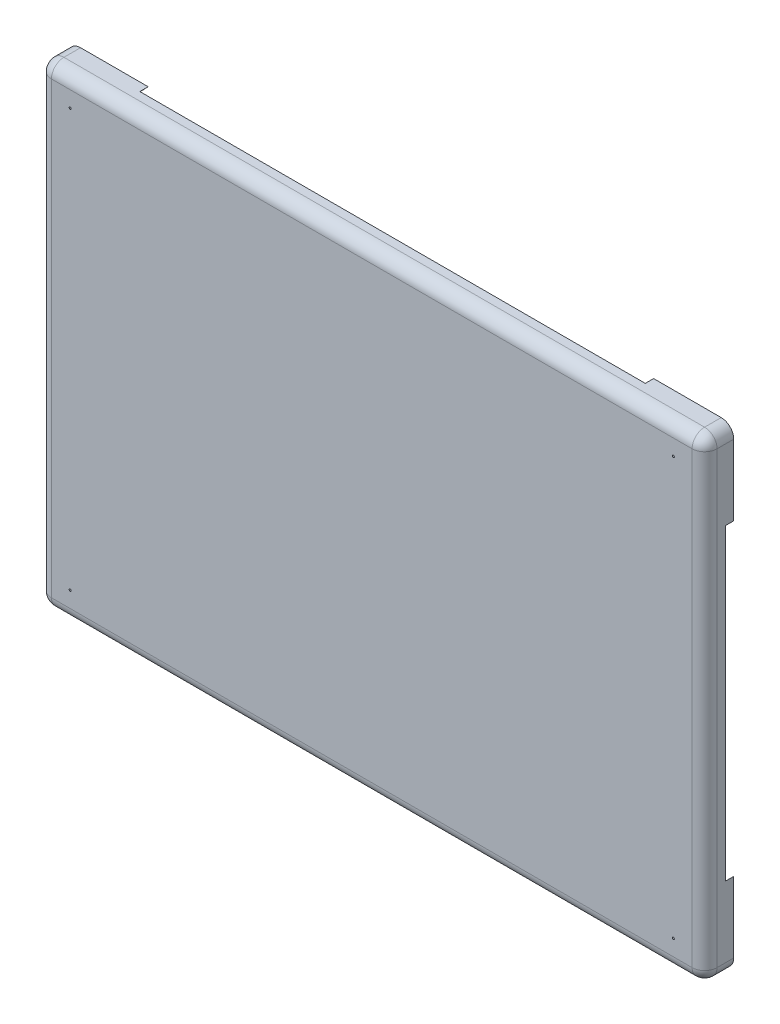
from build123d import *

# Parameters (mm, degrees)
SKETCH2_W                                = 160
SKETCH2_H                                = 114
BOSS_EXTRUDE1_DEPTH                      = 5
FILLET1_R                                = 3
BOSS_EXTRUDE2_DEPTH                      = 2
MIRROR1_AT_THE_SECOND_PLANE_COPY_1_DEPTH = 2


with BuildPart() as part:
    # Sketch2 → Boss-Extrude1 (new body)
    with BuildSketch(Plane.XY):
        Rectangle(SKETCH2_W, SKETCH2_H)
    extrude(amount=BOSS_EXTRUDE1_DEPTH)

    # Fillet1
    fillet1_edges = [part.edges().sort_by_distance(p)[0] for p in [
        (80, 0, 5),
        (0, -57, 5),
        (-80, 0, 5),
        (-80, -57, 2.5),
        (80, -57, 2.5),
        (80, 57, 2.5),
        (-80, 57, 2.5),
        (0, 57, 5),
    ]]
    fillet(fillet1_edges, radius=FILLET1_R)

    # Sketch5 → Boss-Extrude2 (add)
    with BuildSketch(Plane(origin=(0, 0, 0), x_dir=(-1, 0, 0), z_dir=(0, 0, -1))):
        with BuildLine():
            Line((-60.75, 57), (-80, 37))
            Line((-80, 37), (-80, 54))
            ThreePointArc((-80, 54), (-79.121320344, 56.121320344), (-77, 57))
            Line((-77, 57), (-60.75, 57))
        make_face()
    boss_extrude2 = extrude(amount=BOSS_EXTRUDE2_DEPTH)

    # Sketch7 → Ø3.0mm Dowel Hole1 (revolve, cut)
    with BuildSketch(Plane(origin=(72.49, 50.17, -2), x_dir=(0, 1, 0), z_dir=(1, 0, 0))):
        Polygon((0, 0), (0, 7.151506083), (1.75, 6.1), (1.75, 0), align=None)
    f_3_0mm_dowel_hole1 = revolve(axis=Axis((72.49, 50.17, -8.35), (0, 0, 1)), mode=Mode.SUBTRACT)

    # Mirror1: Boss-Extrude2, Ø3.0mm Dowel Hole1 across plane
    add(boss_extrude2.mirror(Plane.ZX))
    add(f_3_0mm_dowel_hole1.mirror(Plane.ZX), mode=Mode.SUBTRACT)

    # Mirror1 at the second plane: Boss-Extrude2, Ø3.0mm Dowel Hole1 across plane
    add(boss_extrude2.mirror(Plane(origin=(0, 0, 0), x_dir=(0, 0, 1), z_dir=(1, 0, 0))))
    add(f_3_0mm_dowel_hole1.mirror(Plane(origin=(0, 0, 0), x_dir=(0, 0, 1), z_dir=(1, 0, 0))), mode=Mode.SUBTRACT)

    # Mirror1 at the second plane copy 1 sketc → Mirror1 at the second plane copy 1 (add)
    with BuildSketch(Plane(origin=(0, 0, 0), x_dir=(1, 0, 0), z_dir=(0, 0, -1))):
        with BuildLine():
            Line((-60.75, 57), (-80, 37))
            Line((-80, 37), (-80, 54))
            ThreePointArc((-80, 54), (-79.121320344, 56.121320344), (-77, 57))
            Line((-77, 57), (-60.75, 57))
        make_face()
    extrude(amount=MIRROR1_AT_THE_SECOND_PLANE_COPY_1_DEPTH)

    # Mirror1 at the second plane copy 2 sketc → Mirror1 at the second plane copy 2 (revolve, cut)
    with BuildSketch(Plane(origin=(-72.49, -50.17, -2), x_dir=(0, -1, 0), z_dir=(-1, 0, 0))):
        Polygon((0, 0), (0, 7.151506083), (1.75, 6.1), (1.75, 0), align=None)
    revolve(axis=Axis((-72.49, -50.17, -8.35), (0, 0, 1)), mode=Mode.SUBTRACT)


solid = part.part
